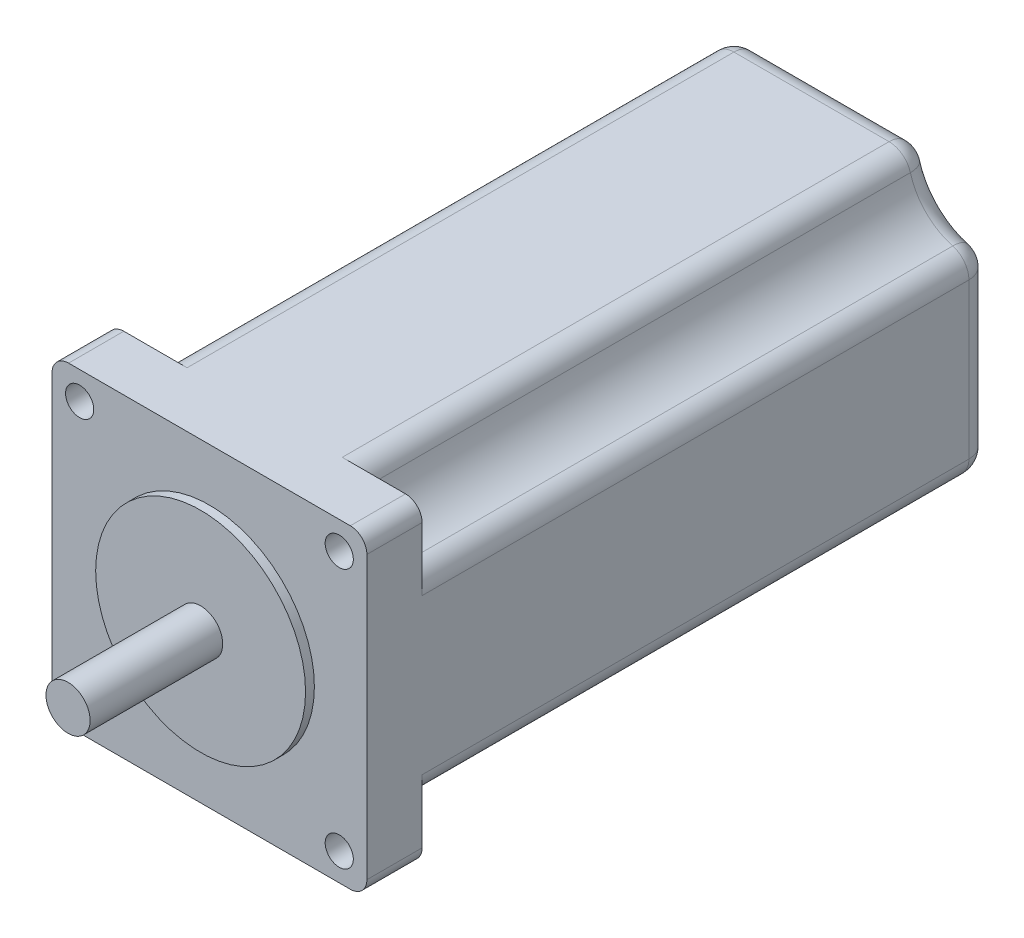
from build123d import *

# Parameters (mm, degrees)
SKETCH1_W           = 57
SKETCH1_H           = 57
BOSS_EXTRUDE1_DEPTH = 113
SKETCH2_R           = 11
CUT_EXTRUDE1_DEPTH  = 103
SKETCH3_R           = 2.55
CUT_EXTRUDE2_DEPTH  = 120.97291361
FILLET2_R           = 3
SKETCH4_R           = 19
BOSS_EXTRUDE2_DEPTH = 1.6
FILLET4_R           = 3
SKETCH6_R           = 4
BOSS_EXTRUDE3_DEPTH = 24
SKETCH7_R           = 6
BOSS_EXTRUDE4_DEPTH = 2
CIRPATTERN4_COUNT   = 4
FILLET5_R           = 4
FILLET6_R           = 4


with BuildPart() as part:
    # Sketch1 → Boss-Extrude1 (new body)
    with BuildSketch(Plane.XY):
        Rectangle(SKETCH1_W, SKETCH1_H)
    extrude(amount=BOSS_EXTRUDE1_DEPTH)

    # Sketch2 → Cut-Extrude1 (cut)
    with BuildSketch(Plane(origin=(0, 0, 0), x_dir=(-1, 0, 0), z_dir=(0, 0, -1))):
        with Locations((-28.5, 28.5)):
            Circle(SKETCH2_R)
    cut_extrude1 = extrude(amount=-CUT_EXTRUDE1_DEPTH, mode=Mode.SUBTRACT)

    # Sketch3 → Cut-Extrude2 (cut, through all)
    with BuildSketch(Plane.XY.offset(113)):
        with Locations((-23.5, 23.5)):
            Circle(SKETCH3_R)
        with Locations((23.5, 23.5)):
            Circle(SKETCH3_R)
        with Locations((23.5, -23.5)):
            Circle(SKETCH3_R)
        with Locations((-23.5, -23.5)):
            Circle(SKETCH3_R)
    extrude(amount=-CUT_EXTRUDE2_DEPTH, mode=Mode.SUBTRACT)

    # Fillet2
    fillet2_edges = [part.edges().sort_by_distance(p)[0] for p in [
        (28.5, 28.5, 108),
    ]]
    fillet(fillet2_edges, radius=FILLET2_R)

    # Sketch4 → Boss-Extrude2 (add)
    with BuildSketch(Plane.XY.offset(113)):
        Circle(SKETCH4_R)
    extrude(amount=BOSS_EXTRUDE2_DEPTH)

    # Fillet4
    fillet4_edges = [part.edges().sort_by_distance(p)[0] for p in [
        (-28.5, 28.5, 56.5),
        (28.5, -28.5, 56.5),
        (-28.5, -28.5, 56.5),
    ]]
    fillet(fillet4_edges, radius=FILLET4_R)

    # Sketch6 → Boss-Extrude3 (add)
    with BuildSketch(Plane.XY.offset(114.6)):
        Circle(SKETCH6_R)
    extrude(amount=BOSS_EXTRUDE3_DEPTH)

    # Sketch7 → Boss-Extrude4 (add)
    with BuildSketch(Plane.ZY.offset(28.5)):
        with Locations(Location((12.240016964, 0, 0), (0, 0, 90))):
            Circle(SKETCH7_R)
    extrude(amount=BOSS_EXTRUDE4_DEPTH)

    # CirPattern4: Cut-Extrude1 ×4 about axis
    cirpattern4_axis = Axis((0, 0, 0), (0, 0, 1))
    for i in range(1, CIRPATTERN4_COUNT):
        add(cut_extrude1.rotate(cirpattern4_axis, i * 360 / CIRPATTERN4_COUNT), mode=Mode.SUBTRACT)

    # Fillet5
    fillet5_edges = [part.edges().sort_by_distance(p)[0] for p in [
        (-28.5, -17.5, 51.5),
        (-17.5, -28.5, 51.5),
        (17.5, -28.5, 51.5),
        (28.5, -17.5, 51.5),
        (28.5, 17.5, 51.5),
        (17.5, 28.5, 51.5),
        (-28.5, 17.5, 51.5),
        (-17.5, 28.5, 51.5),
    ]]
    fillet(fillet5_edges, radius=FILLET5_R)

    # Fillet6
    fillet6_edges = [part.edges().sort_by_distance(p)[0] for p in [
        (-28.5, 0, 0),
        (-20.721825407, 20.721825407, 0),
        (0, 28.5, 0),
        (20.721825407, 20.721825407, 0),
        (28.5, 0, 0),
        (20.721825407, -20.721825407, 0),
        (0, -28.5, 0),
        (-20.721825407, -20.721825407, 0),
        (27.683289703, -16.465287988, 0),
        (16.465287988, -27.683289703, 0),
        (-16.465287988, -27.683289703, 0),
        (-27.683289703, -16.465287988, 0),
        (27.683289703, 16.465287988, 0),
        (16.465287988, 27.683289703, 0),
        (-16.465287988, 27.683289703, 0),
        (-27.683289703, 16.465287988, 0),
    ]]
    fillet(fillet6_edges, radius=FILLET6_R)


solid = part.part
